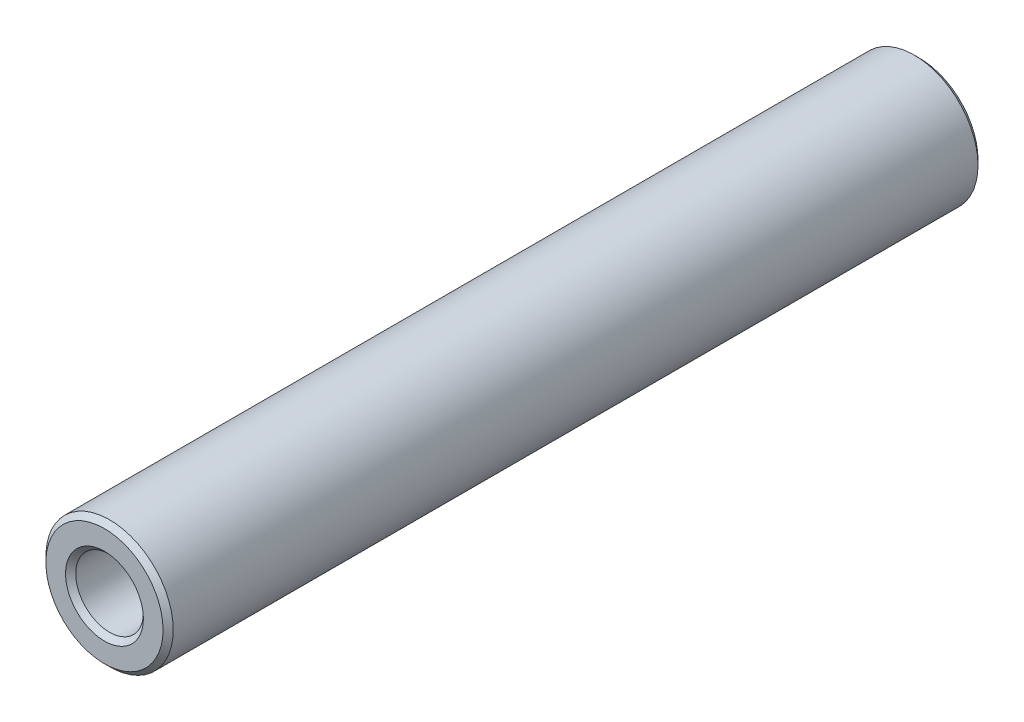
from build123d import *

# Parameters (mm, degrees)
BOSS_EXTRUDE1_DEPTH      = 25.4
BOSS_EXTRUDE1_DEPTH_BACK = 25.4
SKETCH3_R                = 3.96875
SKETCH3_R_2              = 2.1082
CHAMFER1_SIZE            = 0.3175


with BuildPart() as part:
    # Sketch3 → Boss-Extrude1 (new, two sides: drawn at the far end of the back side and taken through both)
    with BuildSketch(Plane.XY.offset(-BOSS_EXTRUDE1_DEPTH_BACK)):
        Circle(SKETCH3_R)
        Circle(SKETCH3_R_2, mode=Mode.SUBTRACT)
    extrude(amount=BOSS_EXTRUDE1_DEPTH + BOSS_EXTRUDE1_DEPTH_BACK)

    # Chamfer1
    chamfer1_edges = [part.edges().sort_by_distance(p)[0] for p in [
        (-3.96875, 0, -25.4),
        (-2.1082, 0, -25.4),
        (-3.96875, 0, 25.4),
        (-2.1082, 0, 25.4),
    ]]
    chamfer(chamfer1_edges, length=CHAMFER1_SIZE)


solid = part.part
